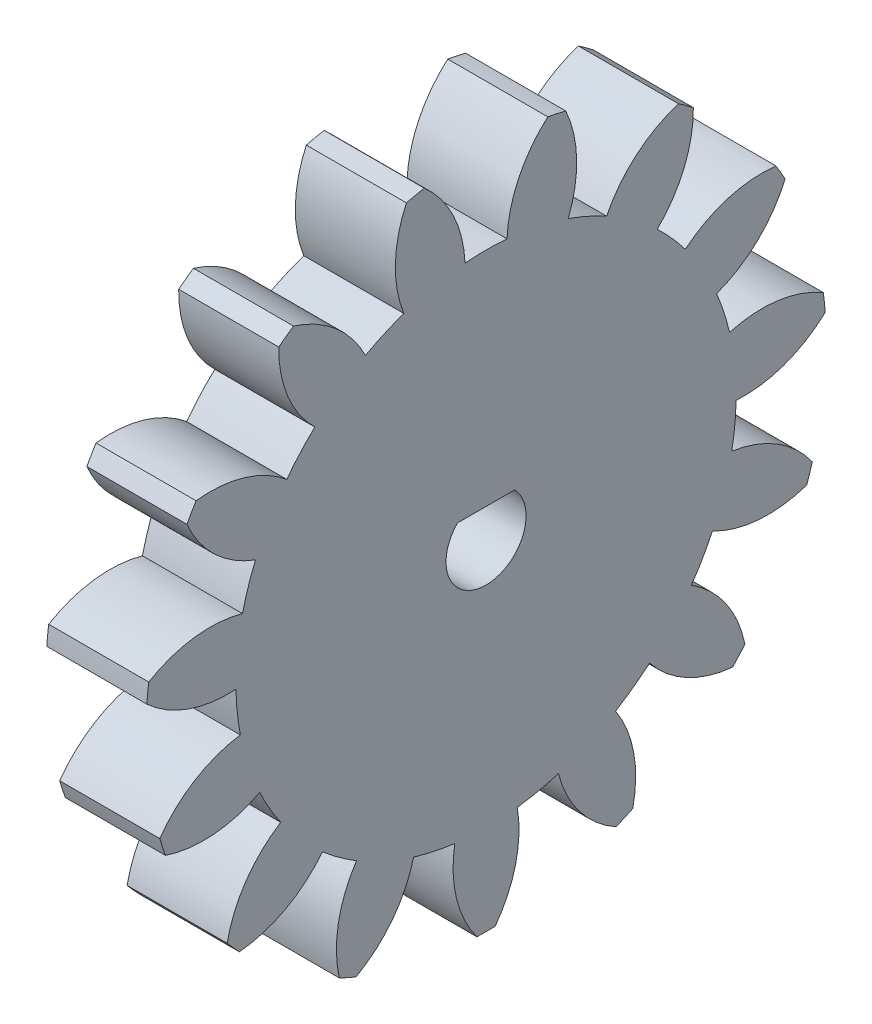
from build123d import *

# Parameters (mm, degrees)
BASPROSKE_W         = 5
BASPROSKE_H         = 17
TOOTHCUT_DEPTH      = 25.556058316
TEETHCUTS_COUNT     = 15
TEETHCUTS_ANGLE     = 336
BORSKE_R            = 2
BORE_DEPTH          = 50.0000508
BOSS_EXTRUDE1_DEPTH = 5


with BuildPart() as part:
    # BasProSke → Base-Revolve (revolve)
    with BuildSketch(Plane(origin=(0, 0, 0), x_dir=(1, 0, 0), z_dir=(0, 1, 0)), mode=Mode.PRIVATE) as base_revolve_sk:
        with Locations((2.5, 8.5)):
            Rectangle(BASPROSKE_W, BASPROSKE_H)
    revolve(base_revolve_sk.sketch.rotate(Axis((-10, 0, 0), (1, 0, 0)), 180), axis=Axis((-10, 0, 0), (1, 0, 0)))

    # TooCutSke → ToothCut (cut, through all)
    with BuildSketch(Plane(origin=(0, 0, 0), x_dir=(0, 0, -1), z_dir=(1, 0, 0))):
        with BuildLine():
            ThreePointArc((1.050056448, 12.454813626), (0, 12.499), (-1.050056448, 12.454813626))
            ThreePointArc((-1.050056448, 12.454813626), (-1.638118106, 14.809604533), (-3.110934279, 16.73876737))
            ThreePointArc((-3.110934279, 16.73876737), (0, 17.0254), (3.110934279, 16.73876737))
            ThreePointArc((3.110934279, 16.73876737), (1.638118106, 14.809604533), (1.050056448, 12.454813626))
        make_face()
    toothcut = extrude(amount=TOOTHCUT_DEPTH, mode=Mode.SUBTRACT)

    # TeethCuts: ToothCut ×15 about axis
    teethcuts_axis = Axis((-10, 0, 0), (1, 0, 0))
    for i in range(1, TEETHCUTS_COUNT):
        add(toothcut.rotate(teethcuts_axis, i * TEETHCUTS_ANGLE / (TEETHCUTS_COUNT - 1)), mode=Mode.SUBTRACT)

    # BorSke → Bore (cut, symmetric)
    with BuildSketch(Plane(origin=(0, 0, 0), x_dir=(0, 0, -1), z_dir=(1, 0, 0))):
        with Locations(Location((0, 0, 0), (0, 0, 180))):
            Circle(BORSKE_R)
    extrude(amount=BORE_DEPTH, both=True, mode=Mode.SUBTRACT)

    # Sketch1 → Boss-Extrude1 (add)
    with BuildSketch(Plane(origin=(5, 0, 0), x_dir=(0, 0, -1), z_dir=(1, 0, 0))):
        with BuildLine():
            Line((-1.428285686, 1.4), (1.428285686, 1.4))
            ThreePointArc((1.428285686, 1.4), (0, 2), (-1.428285686, 1.4))
        make_face()
    extrude(amount=-BOSS_EXTRUDE1_DEPTH)


solid = part.part
